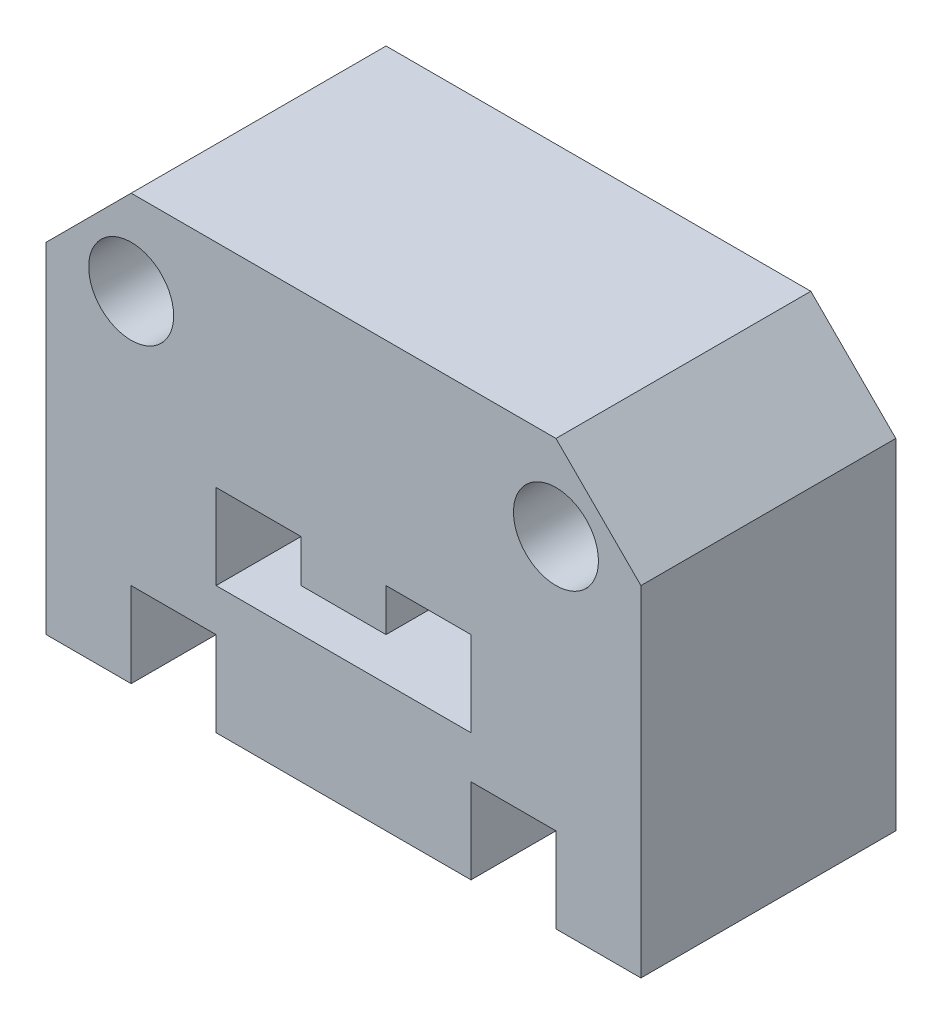
from build123d import *

# Parameters (mm, degrees)
SKETCH1_R           = 5
BOSS_EXTRUDE1_DEPTH = 15


with BuildPart() as part:
    # Sketch1 → Boss-Extrude1 (new, symmetric)
    with BuildSketch(Plane.XY):
        Polygon((-35, 40), (-25, 50), (25, 50), (35, 40), (35, 0), (25, 0), (25, 10), (15, 10), (15, 0), (-15, 0), (-15, 10), (-25, 10), (-25, 0), (-35, 0), align=None)
        with Locations((-25, 40)):
            Circle(SKETCH1_R, mode=Mode.SUBTRACT)
        with Locations((25, 40)):
            Circle(SKETCH1_R, mode=Mode.SUBTRACT)
        Polygon((-5, 25), (-5, 20), (5, 20), (5, 25), (15, 25), (15, 15), (-15, 15), (-15, 25), align=None, mode=Mode.SUBTRACT)
    extrude(amount=BOSS_EXTRUDE1_DEPTH, both=True)


solid = part.part
